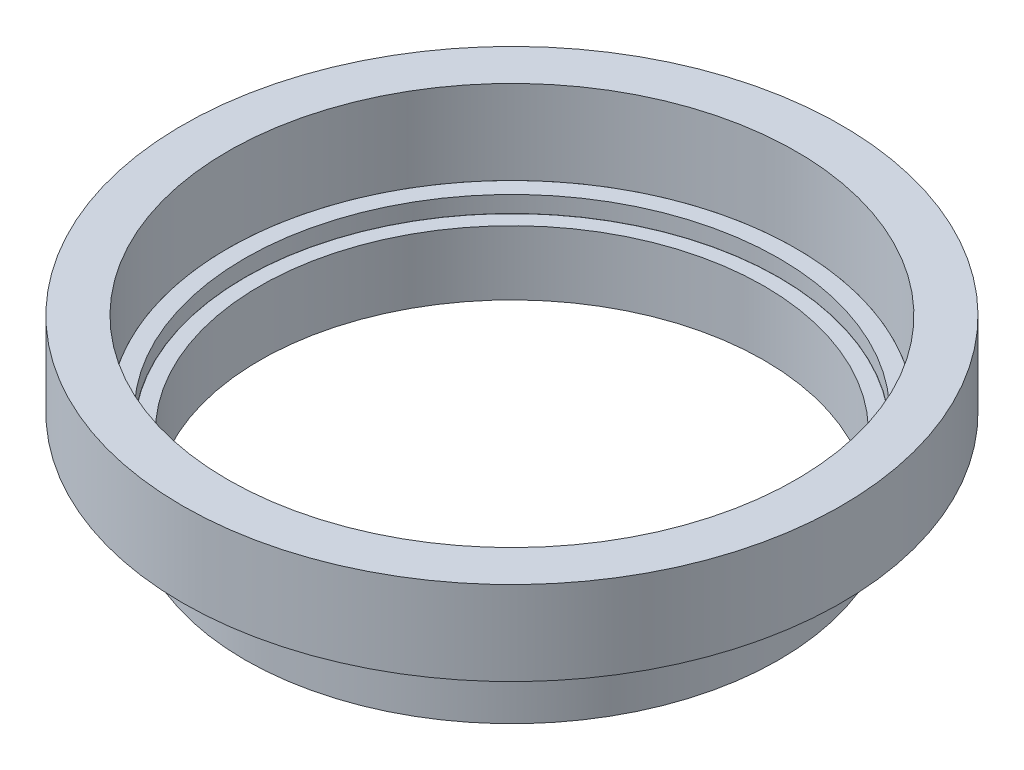
from build123d import *

# Parameters (mm, degrees)
SKETCH1_R                = 50.8
SKETCH1_R_2              = 43.815
BOSS_EXTRUDE1_DEPTH      = 12.954
SKETCH2_R                = 43.815
SKETCH2_R_2              = 41.1734
BOSS_EXTRUDE2_DEPTH      = 2.54
BOSS_EXTRUDE3_DEPTH      = 7.366
BOSS_EXTRUDE3_DEPTH_BACK = 2.54
SKETCH3_R                = 41.148
SKETCH3_R_2              = 38.862


with BuildPart() as part:
    # Sketch1 → Boss-Extrude1 (new body)
    with BuildSketch(Plane(origin=(0, 0, 0), x_dir=(1, 0, 0), z_dir=(0, 1, 0))):
        with Locations(Location((0, 0, 0), (0, 0, 270))):
            Circle(SKETCH1_R)
        with Locations(Location((0, 0, 0), (0, 0, 270))):
            Circle(SKETCH1_R_2, mode=Mode.SUBTRACT)
    extrude(amount=-BOSS_EXTRUDE1_DEPTH)


with BuildPart() as body_2:
    # Sketch2 → Boss-Extrude2 (new body)
    with BuildSketch(Plane(origin=(0, -15.494, 0), x_dir=(-1, 0, 0), z_dir=(0, -1, 0))):
        with Locations(Location((0, 0, 0), (0, 0, 90))):
            Circle(SKETCH2_R)
        with Locations(Location((0, 0, 0), (0, 0, 90))):
            Circle(SKETCH2_R_2, mode=Mode.SUBTRACT)
    extrude(amount=-BOSS_EXTRUDE2_DEPTH)


with BuildPart() as body_3:
    # Sketch3 → Boss-Extrude3 (new, two sides: drawn at the far end of the back side and taken through both)
    with BuildSketch(Plane(origin=(0, -18.034, 0), x_dir=(-1, 0, 0), z_dir=(0, -1, 0)).offset(-BOSS_EXTRUDE3_DEPTH_BACK)):
        with Locations(Location((0, 0, 0), (0, 0, 90))):
            Circle(SKETCH3_R)
        with Locations(Location((0, 0, 0), (0, 0, 90))):
            Circle(SKETCH3_R_2, mode=Mode.SUBTRACT)
    extrude(amount=BOSS_EXTRUDE3_DEPTH + BOSS_EXTRUDE3_DEPTH_BACK)


solid = Compound([part.part, body_2.part, body_3.part])
